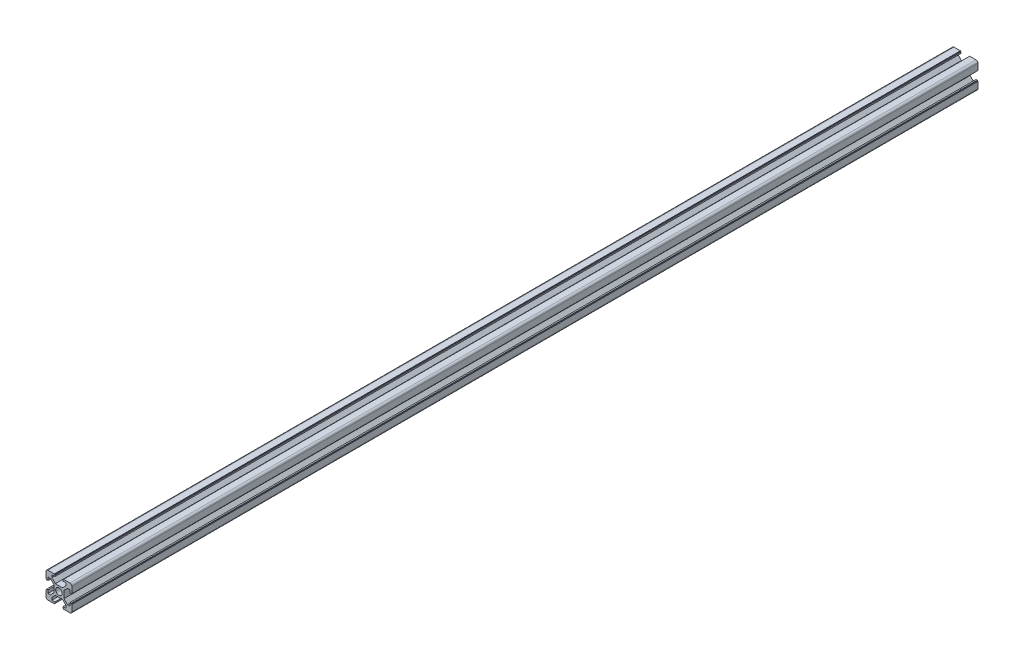
from build123d import *

# Parameters (mm, degrees)
SKETCH13_R               = 2.5
F_20_X_20_X_R1_5_1_DEPTH = 700


with BuildPart() as part:
    # Sketch13 → 铝型材 20 X 20 X R1.5(1) (new body)
    with BuildSketch(Plane.YX):
        with BuildLine():
            Line((-3.6, 10), (-3.6, 9.5))
            Line((-3.6, 9.5), (-3.1, 9.5))
            Line((-3.1, 9.5), (-3.1, 8.5))
            Line((-3.1, 8.5), (-5.5, 8.5))
            Line((-5.5, 8.5), (-5.5, 6.65))
            Line((-5.5, 6.65), (-2.75, 3.9))
            Line((-2.75, 3.9), (2.75, 3.9))
            Line((2.75, 3.9), (5.5, 6.65))
            Line((5.5, 6.65), (5.5, 8.5))
            Line((5.5, 8.5), (3.1, 8.5))
            Line((3.1, 8.5), (3.1, 9.5))
            Line((3.1, 9.5), (3.6, 9.5))
            Line((3.6, 9.5), (3.6, 10))
            Line((3.6, 10), (8.5, 10))
            ThreePointArc((8.5, 10), (9.560660172, 9.560660172), (10, 8.5))
            Line((10, 8.5), (10, 3.6))
            Line((10, 3.6), (9.5, 3.6))
            Line((9.5, 3.6), (9.5, 3.1))
            Line((9.5, 3.1), (8.5, 3.1))
            Line((8.5, 3.1), (8.5, 5.5))
            Line((8.5, 5.5), (6.65, 5.5))
            Line((6.65, 5.5), (3.9, 2.75))
            Line((3.9, 2.75), (3.9, -2.75))
            Line((3.9, -2.75), (6.65, -5.5))
            Line((6.65, -5.5), (8.5, -5.5))
            Line((8.5, -5.5), (8.5, -3.1))
            Line((8.5, -3.1), (9.5, -3.1))
            Line((9.5, -3.1), (9.5, -3.6))
            Line((9.5, -3.6), (10, -3.6))
            Line((10, -3.6), (10, -8.5))
            ThreePointArc((10, -8.5), (9.560660172, -9.560660172), (8.5, -10))
            Line((8.5, -10), (3.6, -10))
            Line((3.6, -10), (3.6, -9.5))
            Line((3.6, -9.5), (3.1, -9.5))
            Line((3.1, -9.5), (3.1, -8.5))
            Line((3.1, -8.5), (5.5, -8.5))
            Line((5.5, -8.5), (5.5, -6.65))
            Line((5.5, -6.65), (2.75, -3.9))
            Line((2.75, -3.9), (-2.75, -3.9))
            Line((-2.75, -3.9), (-5.5, -6.65))
            Line((-5.5, -6.65), (-5.5, -8.5))
            Line((-5.5, -8.5), (-3.1, -8.5))
            Line((-3.1, -8.5), (-3.1, -9.5))
            Line((-3.1, -9.5), (-3.6, -9.5))
            Line((-3.6, -9.5), (-3.6, -10))
            Line((-3.6, -10), (-8.5, -10))
            ThreePointArc((-8.5, -10), (-9.560660172, -9.560660172), (-10, -8.5))
            Line((-10, -8.5), (-10, -3.6))
            Line((-10, -3.6), (-9.5, -3.6))
            Line((-9.5, -3.6), (-9.5, -3.1))
            Line((-9.5, -3.1), (-8.5, -3.1))
            Line((-8.5, -3.1), (-8.5, -5.5))
            Line((-8.5, -5.5), (-6.65, -5.5))
            Line((-6.65, -5.5), (-3.9, -2.75))
            Line((-3.9, -2.75), (-3.9, 2.75))
            Line((-3.9, 2.75), (-6.65, 5.5))
            Line((-6.65, 5.5), (-8.5, 5.5))
            Line((-8.5, 5.5), (-8.5, 3.1))
            Line((-8.5, 3.1), (-9.5, 3.1))
            Line((-9.5, 3.1), (-9.5, 3.6))
            Line((-9.5, 3.6), (-10, 3.6))
            Line((-10, 3.6), (-10, 8.5))
            ThreePointArc((-10, 8.5), (-9.560660172, 9.560660172), (-8.5, 10))
            Line((-8.5, 10), (-3.6, 10))
        make_face()
        Circle(SKETCH13_R, mode=Mode.SUBTRACT)
    extrude(amount=F_20_X_20_X_R1_5_1_DEPTH)


solid = part.part
